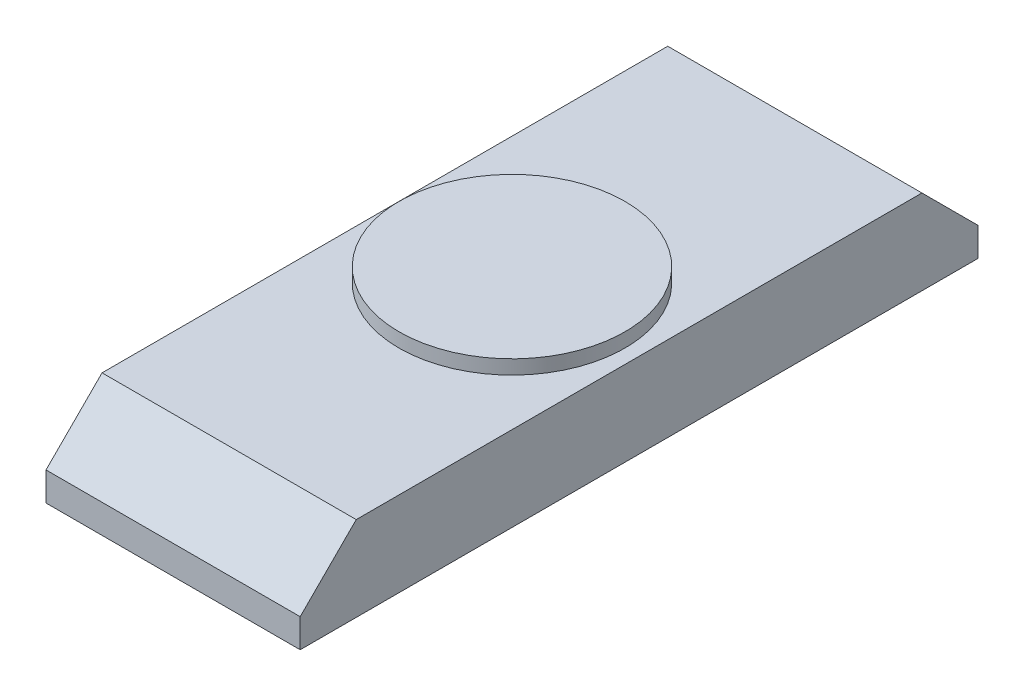
from build123d import *

# Parameters (mm, degrees)
SKETCH2_W           = 57.15
SKETCH2_H           = 152.4
BOSS_EXTRUDE1_DEPTH = 19.05
CUT_EXTRUDE2_DEPTH  = 57.15
SKETCH5_R           = 25.4
BOSS_EXTRUDE2_DEPTH = 3.175


with BuildPart() as part:
    # Sketch2 → Boss-Extrude1 (new body)
    with BuildSketch(Plane(origin=(0, 0, 0), x_dir=(1, 0, 0), z_dir=(0, 1, 0))):
        with Locations((28.575, -76.2)):
            Rectangle(SKETCH2_W, SKETCH2_H)
    extrude(amount=BOSS_EXTRUDE1_DEPTH)

    # Sketch3 → Cut-Extrude2 (cut)
    with BuildSketch(Plane(origin=(57.15, 0, 0), x_dir=(0, 0, -1), z_dir=(1, 0, 0))):
        Polygon((-152.4, 6.447169547), (-139.797169547, 19.05), (-152.4, 19.05), align=None)
        Polygon((0, 6.447169547), (-12.602830453, 19.05), (0, 19.05), align=None)
    extrude(amount=-CUT_EXTRUDE2_DEPTH, mode=Mode.SUBTRACT)

    # Sketch5 → Boss-Extrude2 (add)
    with BuildSketch(Plane(origin=(0, 19.05, 0), x_dir=(1, 0, 0), z_dir=(0, 1, 0))):
        with Locations(Location((28.575, -76.2, 0), (0, 0, 270))):
            Circle(SKETCH5_R)
    extrude(amount=BOSS_EXTRUDE2_DEPTH)


solid = part.part
